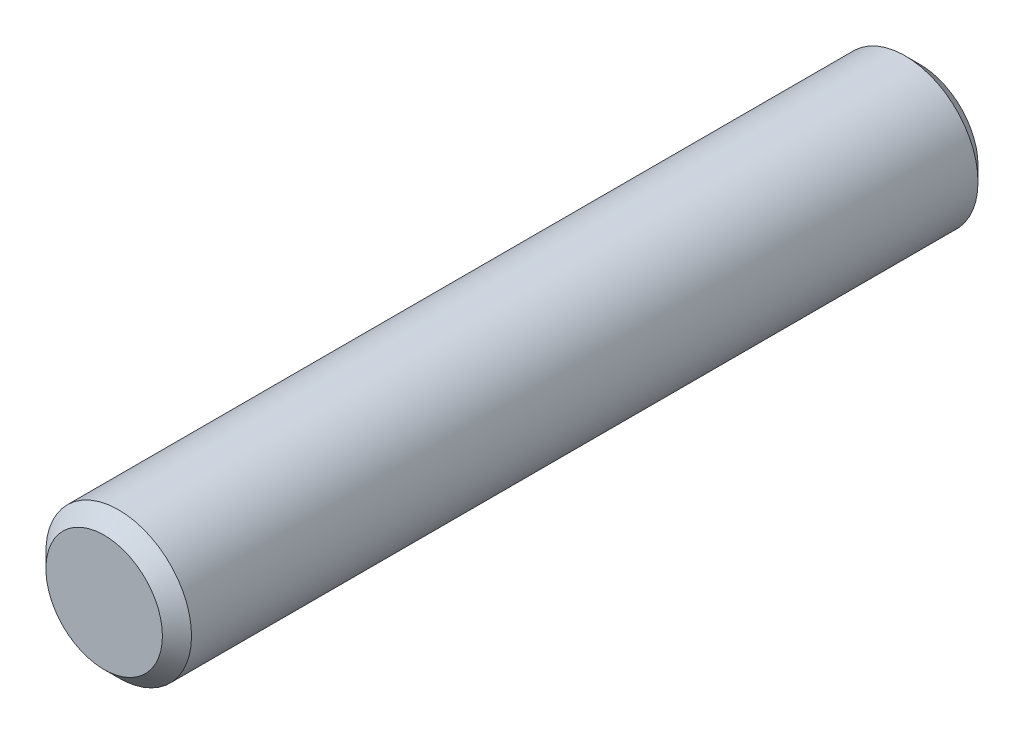
from build123d import *

# Parameters (mm, degrees)
SKETCH1_R           = 2.5
BOSS_EXTRUDE1_DEPTH = 28
CHAMFER1_SIZE       = 0.5


with BuildPart() as part:
    # Sketch1 → Boss-Extrude1 (new body)
    with BuildSketch(Plane.XY):
        Circle(SKETCH1_R)
    extrude(amount=-BOSS_EXTRUDE1_DEPTH)

    # Chamfer1
    chamfer1_edges = [part.edges().sort_by_distance(p)[0] for p in [
        (-2.5, 0, 0),
        (-2.5, 0, -28),
    ]]
    chamfer(chamfer1_edges, length=CHAMFER1_SIZE)


solid = part.part
